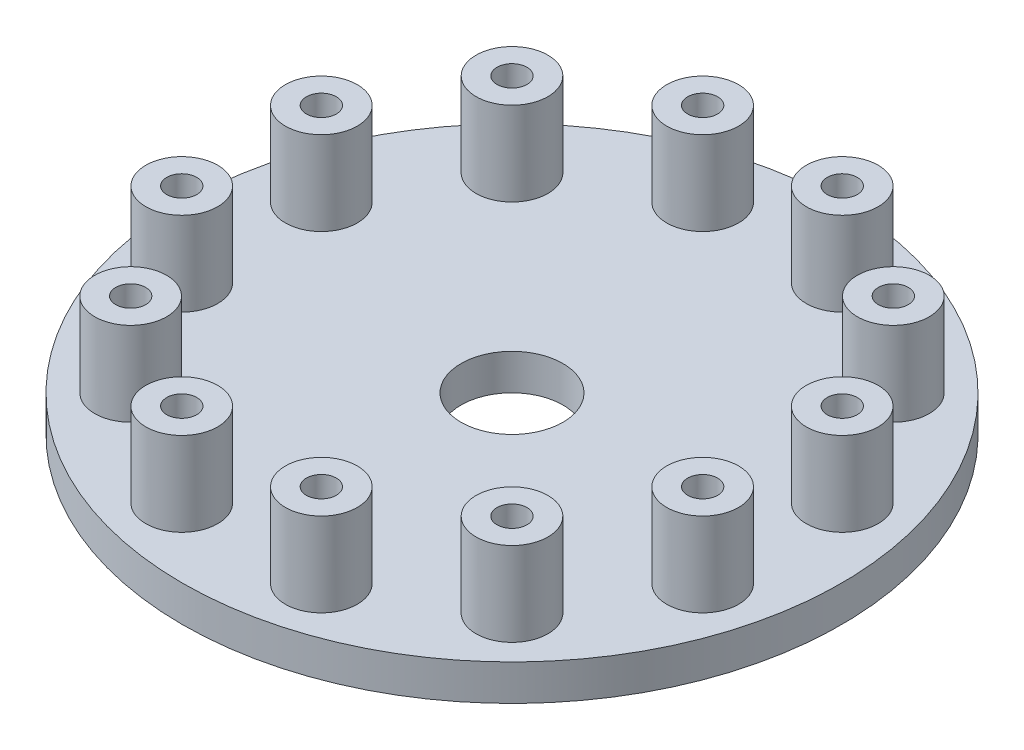
from build123d import *

# Parameters (mm, degrees)
SKETCH1_R           = 27.5
SKETCH1_R_2         = 3
SKETCH1_R_3         = 4.25
BOSS_EXTRUDE1_DEPTH = 3
SKETCH2_R           = 3
BOSS_EXTRUDE2_DEPTH = 10
M3_TAPPED_HOLE1_D   = 2.5
CIRPATTERN1_COUNT   = 12


with BuildPart() as part:
    # Sketch1 → Boss-Extrude1 (new body)
    with BuildSketch(Plane(origin=(0, 0, 0), x_dir=(1, 0, 0), z_dir=(0, 1, 0))):
        with Locations(Location((0, 0, 0), (0, 0, 270))):
            Circle(SKETCH1_R)
        with Locations(Location((21.733331092, -5.823428515, 0), (0, 0, 270))):
            Circle(SKETCH1_R_2, mode=Mode.SUBTRACT)
        with Locations(Location((15.909902577, -15.909902577, 0), (0, 0, 270))):
            Circle(SKETCH1_R_2, mode=Mode.SUBTRACT)
        with Locations(Location((5.823428515, -21.733331092, 0), (0, 0, 270))):
            Circle(SKETCH1_R_2, mode=Mode.SUBTRACT)
        with Locations(Location((-5.823428515, -21.733331092, 0), (0, 0, 270))):
            Circle(SKETCH1_R_2, mode=Mode.SUBTRACT)
        with Locations(Location((-15.909902577, -15.909902577, 0), (0, 0, 270))):
            Circle(SKETCH1_R_2, mode=Mode.SUBTRACT)
        with Locations(Location((-21.733331092, -5.823428515, 0), (0, 0, 270))):
            Circle(SKETCH1_R_2, mode=Mode.SUBTRACT)
        with Locations(Location((-21.733331092, 5.823428515, 0), (0, 0, 270))):
            Circle(SKETCH1_R_2, mode=Mode.SUBTRACT)
        with Locations(Location((-15.909902577, 15.909902577, 0), (0, 0, 270))):
            Circle(SKETCH1_R_2, mode=Mode.SUBTRACT)
        with Locations(Location((-5.823428515, 21.733331092, 0), (0, 0, 270))):
            Circle(SKETCH1_R_2, mode=Mode.SUBTRACT)
        with Locations(Location((5.823428515, 21.733331092, 0), (0, 0, 270))):
            Circle(SKETCH1_R_2, mode=Mode.SUBTRACT)
        with Locations(Location((15.909902577, 15.909902577, 0), (0, 0, 270))):
            Circle(SKETCH1_R_2, mode=Mode.SUBTRACT)
        with Locations(Location((21.733331092, 5.823428515, 0), (0, 0, 270))):
            Circle(SKETCH1_R_2, mode=Mode.SUBTRACT)
        with Locations(Location((0, 0, 0), (0, 0, 270))):
            Circle(SKETCH1_R_3, mode=Mode.SUBTRACT)
    extrude(amount=BOSS_EXTRUDE1_DEPTH)

    # Sketch2 → Boss-Extrude2 (add)
    with BuildSketch(Plane.XZ):
        with Locations(Location((15.909902577, 15.909902577, 0), (0, 0, 270))):
            Circle(SKETCH2_R)
        with Locations(Location((21.733331092, 5.823428515, 0), (0, 0, 270))):
            Circle(SKETCH2_R)
        with Locations(Location((21.733331092, -5.823428515, 0), (0, 0, 270))):
            Circle(SKETCH2_R)
        with Locations(Location((15.909902577, -15.909902577, 0), (0, 0, 270))):
            Circle(SKETCH2_R)
        with Locations(Location((5.823428515, -21.733331092, 0), (0, 0, 270))):
            Circle(SKETCH2_R)
        with Locations(Location((-5.823428515, -21.733331092, 0), (0, 0, 270))):
            Circle(SKETCH2_R)
        with Locations(Location((-15.909902577, -15.909902577, 0), (0, 0, 270))):
            Circle(SKETCH2_R)
        with Locations(Location((-21.733331092, -5.823428515, 0), (0, 0, 270))):
            Circle(SKETCH2_R)
        with Locations(Location((-21.733331092, 5.823428515, 0), (0, 0, 270))):
            Circle(SKETCH2_R)
        with Locations(Location((-15.909902577, 15.909902577, 0), (0, 0, 270))):
            Circle(SKETCH2_R)
        with Locations(Location((-5.823428515, 21.733331092, 0), (0, 0, 270))):
            Circle(SKETCH2_R)
        with Locations(Location((5.823428515, 21.733331092, 0), (0, 0, 270))):
            Circle(SKETCH2_R)
    extrude(amount=-BOSS_EXTRUDE2_DEPTH)

    # M3 Tapped Hole1 (through all)
    with Locations(Plane(origin=(0, 10, 0), x_dir=(1, 0, 0), z_dir=(0, 1, 0))):
        with Locations((-5.823428515, 21.733331092)):
            m3_tapped_hole1 = Hole(M3_TAPPED_HOLE1_D / 2)

    # CirPattern1: M3 Tapped Hole1 ×12 about axis
    cirpattern1_axis = Axis((0, 0, 0), (0, 1, 0))
    for i in range(1, CIRPATTERN1_COUNT):
        add(m3_tapped_hole1.rotate(cirpattern1_axis, i * 360 / CIRPATTERN1_COUNT), mode=Mode.SUBTRACT)


solid = part.part
